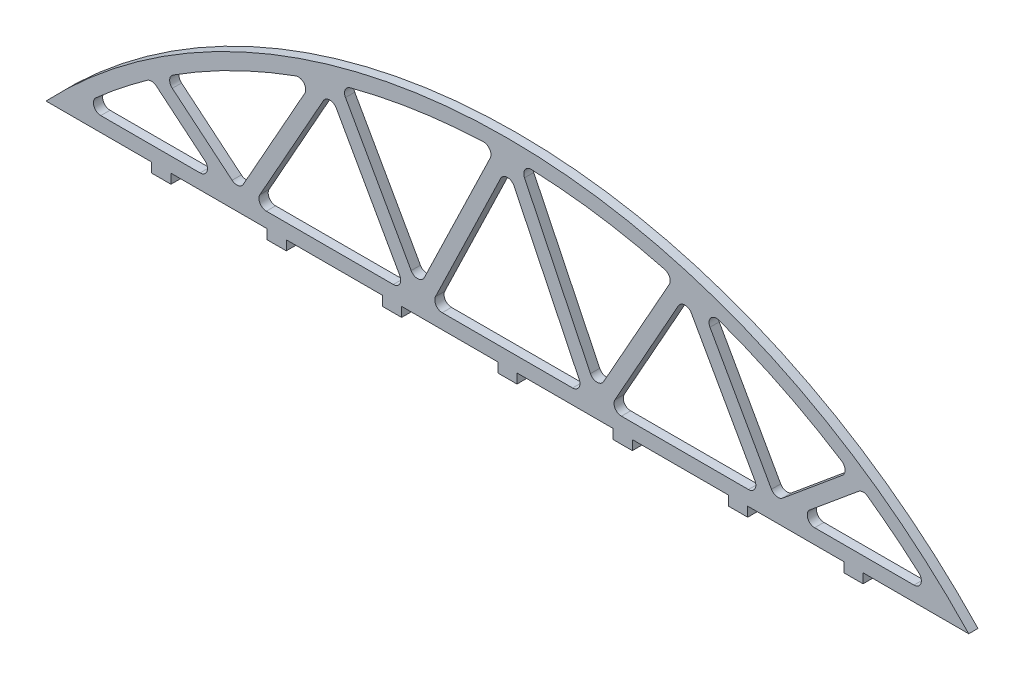
from build123d import *

# Parameters (mm, degrees)
BOSS_EXTRUDE1_DEPTH = 3.175
SCALE2_SCALE        = 0.962039453
SKETCH2_W           = 6.35
SKETCH2_H           = 3.175
BOSS_EXTRUDE2_DEPTH = 3.175


with BuildPart() as part:
    # Sketch1 → Boss-Extrude1 (new body)
    with BuildSketch(Plane.XY):
        with BuildLine():
            Line((-147.158374537, -62.773274702), (169.668548728, -62.773274702))
            ThreePointArc((169.668548728, -62.773274702), (11.255087096, 5.432872204), (-147.158374537, -62.773274702))
        make_face()
        with BuildLine():
            Line((50.41023946, -57.693274702), (94.019934732, -57.693274702))
            ThreePointArc((94.019934732, -57.693274702), (96.211786347, -56.436780252), (96.235095135, -53.910429423))
            Line((96.235095135, -53.910429423), (74.430247499, -15.046995704))
            ThreePointArc((74.430247499, -15.046995704), (72.215087096, -13.749840983), (69.999926692, -15.046995704))
            Line((69.999926692, -15.046995704), (48.195079056, -53.910429423))
            ThreePointArc((48.195079056, -53.910429423), (48.218387844, -56.436780252), (50.41023946, -57.693274702))
        make_face(mode=Mode.SUBTRACT)
        with BuildLine():
            Line((105.763734274, -54.380906597), (126.29666869, -37.319025838))
            ThreePointArc((126.29666869, -37.319025838), (127.208455368, -35.207887623), (126.042260143, -33.225906744))
            ThreePointArc((126.042260143, -33.225906744), (105.546270909, -21.656125731), (83.898857508, -12.418436605))
            ThreePointArc((83.898857508, -12.418436605), (81.096030012, -13.162488886), (80.817372324, -16.048975619))
            Line((80.817372324, -16.048975619), (101.925252726, -53.670183739))
            ThreePointArc((101.925252726, -53.670183739), (103.677973758, -54.924887225), (105.763734274, -54.380906597))
        make_face(mode=Mode.SUBTRACT)
        with BuildLine():
            Line((44.287940881, -50.492254775), (66.833764967, -10.308156511))
            ThreePointArc((66.833764967, -10.308156511), (66.956550428, -8.072532741), (65.262680667, -6.608328129))
            ThreePointArc((65.262680667, -6.608328129), (42.578611895, -1.963069006), (19.524331112, 0.19228386))
            ThreePointArc((19.524331112, 0.19228386), (17.300963083, -0.95402892), (17.138389089, -3.450219634))
            Line((17.138389089, -3.450219634), (39.785454632, -50.353828112))
            ThreePointArc((39.785454632, -50.353828112), (41.994726342, -51.788209913), (44.287940881, -50.492254775))
        make_face(mode=Mode.SUBTRACT)
        with BuildLine():
            Line((-21.777766689, -50.492254775), (-44.323590776, -10.308156511))
            ThreePointArc((-44.323590776, -10.308156511), (-44.446376237, -8.072532741), (-42.752506476, -6.608328129))
            ThreePointArc((-42.752506476, -6.608328129), (-20.068437704, -1.963069006), (2.985843079, 0.19228386))
            ThreePointArc((2.985843079, 0.19228386), (5.209211108, -0.95402892), (5.371785102, -3.450219634))
            Line((5.371785102, -3.450219634), (-17.275280441, -50.353828112))
            ThreePointArc((-17.275280441, -50.353828112), (-19.484552151, -51.788209913), (-21.777766689, -50.492254775))
        make_face(mode=Mode.SUBTRACT)
        with BuildLine():
            Line((-58.307198133, -16.048975619), (-79.415078535, -53.670183739))
            ThreePointArc((-79.415078535, -53.670183739), (-81.167799567, -54.924887225), (-83.253560083, -54.380906597))
            Line((-83.253560083, -54.380906597), (-103.786494499, -37.319025838))
            ThreePointArc((-103.786494499, -37.319025838), (-104.698281177, -35.207887623), (-103.532085952, -33.225906744))
            ThreePointArc((-103.532085952, -33.225906744), (-83.036096718, -21.656125731), (-61.388683317, -12.418436605))
            ThreePointArc((-61.388683317, -12.418436605), (-58.585855821, -13.162488886), (-58.307198133, -16.048975619))
        make_face(mode=Mode.SUBTRACT)
        with BuildLine():
            Line((-128.343015855, -57.693274702), (-94.247026375, -57.693274702))
            ThreePointArc((-94.247026375, -57.693274702), (-91.858128819, -56.016274393), (-92.623705231, -53.199706566))
            Line((-92.623705231, -53.199706566), (-109.306769117, -39.336883017))
            ThreePointArc((-109.306769117, -39.336883017), (-110.836303138, -38.752183245), (-112.404816005, -39.222412473))
            ThreePointArc((-112.404816005, -39.222412473), (-121.401975006, -46.004337694), (-130.027908578, -53.252554703))
            ThreePointArc((-130.027908578, -53.252554703), (-130.717824142, -56.054321649), (-128.343015855, -57.693274702))
        make_face(mode=Mode.SUBTRACT)
        with BuildLine():
            Line((13.542412941, -7.685960278), (35.928399311, -54.048856086))
            ThreePointArc((35.928399311, -54.048856086), (35.792447827, -56.503529625), (33.641073466, -57.693274702))
            Line((33.641073466, -57.693274702), (-11.130899275, -57.693274702))
            ThreePointArc((-11.130899275, -57.693274702), (-13.282273636, -56.503529625), (-13.41822512, -54.048856086))
            Line((-13.41822512, -54.048856086), (8.96776125, -7.685960278))
            ThreePointArc((8.96776125, -7.685960278), (11.255087096, -6.250378893), (13.542412941, -7.685960278))
        make_face(mode=Mode.SUBTRACT)
        with BuildLine():
            Line((-25.684904865, -53.910429423), (-47.489752501, -15.046995704))
            ThreePointArc((-47.489752501, -15.046995704), (-49.704912904, -13.749840983), (-51.920073308, -15.046995704))
            Line((-51.920073308, -15.046995704), (-73.724920944, -53.910429423))
            ThreePointArc((-73.724920944, -53.910429423), (-73.701612156, -56.436780252), (-71.50976054, -57.693274702))
            Line((-71.50976054, -57.693274702), (-27.900065268, -57.693274702))
            ThreePointArc((-27.900065268, -57.693274702), (-25.708213653, -56.436780252), (-25.684904865, -53.910429423))
        make_face(mode=Mode.SUBTRACT)
        with BuildLine():
            Line((115.133879422, -53.199706566), (131.816943308, -39.336883017))
            ThreePointArc((131.816943308, -39.336883017), (133.346477329, -38.752183245), (134.914990196, -39.222412473))
            ThreePointArc((134.914990196, -39.222412473), (143.912149197, -46.004337694), (152.538082769, -53.252554703))
            ThreePointArc((152.538082769, -53.252554703), (153.227998333, -56.054321649), (150.853190046, -57.693274702))
            Line((150.853190046, -57.693274702), (116.757200566, -57.693274702))
            ThreePointArc((116.757200566, -57.693274702), (114.36830301, -56.016274393), (115.133879422, -53.199706566))
        make_face(mode=Mode.SUBTRACT)
    extrude(amount=BOSS_EXTRUDE1_DEPTH)


with BuildPart() as part_1:
    # Scale2: scaled about (11.255087096, -36.675334956, 1.5875)
    add(part.part.scale(SCALE2_SCALE).moved(Location((0.427249265, -1.392215783, 0.060262369))))

    # Sketch2 → Boss-Extrude2 (add)
    with BuildSketch(Plane.XY.offset(3.114737631)):
        with Locations((-103.044912854, -63.370082629)):
            Rectangle(SKETCH2_W, SKETCH2_H)
        with Locations((-64.944912854, -63.370082629)):
            Rectangle(SKETCH2_W, SKETCH2_H)
        with Locations((-26.844912854, -63.370082629)):
            Rectangle(SKETCH2_W, SKETCH2_H)
        with Locations((11.255087146, -63.370082629)):
            Rectangle(SKETCH2_W, SKETCH2_H)
        with Locations((49.355087146, -63.370082629)):
            Rectangle(SKETCH2_W, SKETCH2_H)
        with Locations((87.455087146, -63.370082629)):
            Rectangle(SKETCH2_W, SKETCH2_H)
        with Locations((125.555087146, -63.370082629)):
            Rectangle(SKETCH2_W, SKETCH2_H)
    extrude(amount=-BOSS_EXTRUDE2_DEPTH)


solid = part_1.part
